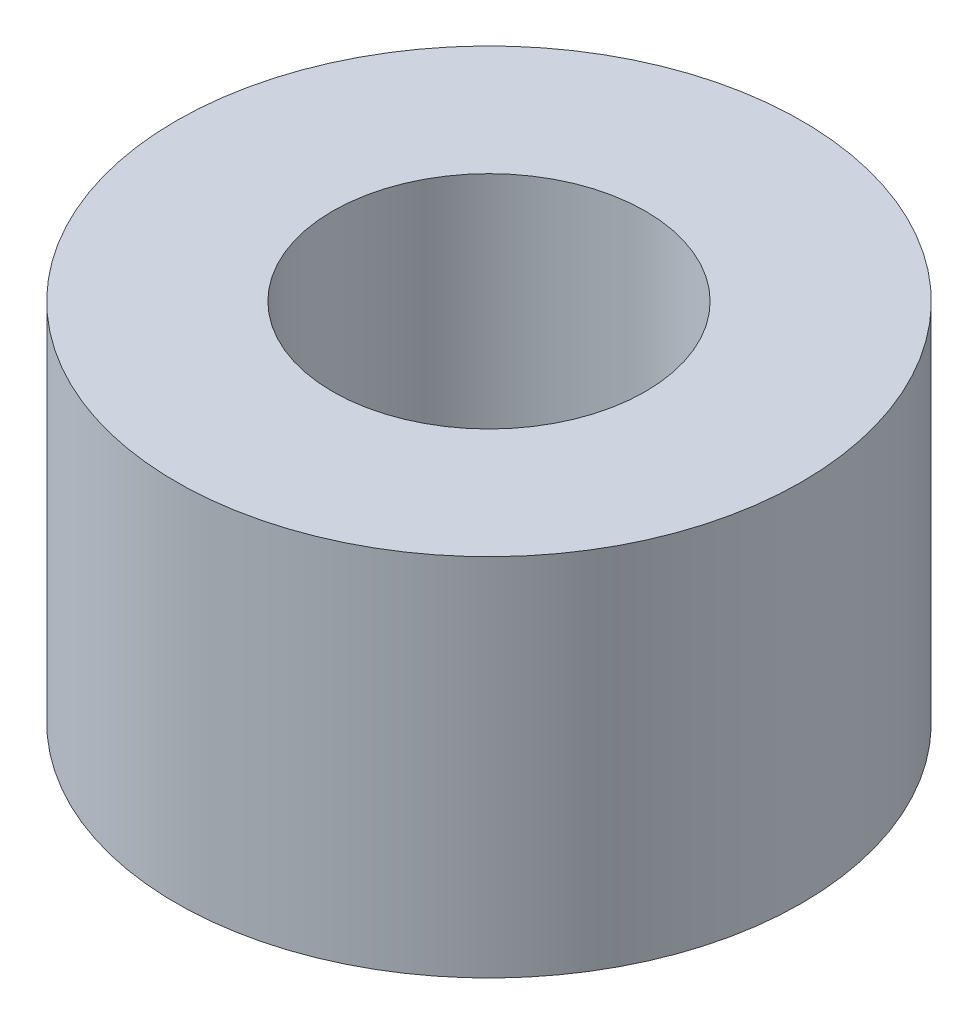
from build123d import *

# Parameters (mm, degrees)
SKETCH1_R           = 6
SKETCH1_R_2         = 3
EXTRUDE_THIN1_DEPTH = 7


with BuildPart() as part:
    # Sketch1 → Extrude-Thin1 (new body)
    with BuildSketch(Plane(origin=(0, 0, 0), x_dir=(1, 0, 0), z_dir=(0, 1, 0))):
        Circle(SKETCH1_R)
        Circle(SKETCH1_R_2, mode=Mode.SUBTRACT)
    extrude(amount=EXTRUDE_THIN1_DEPTH)


solid = part.part
